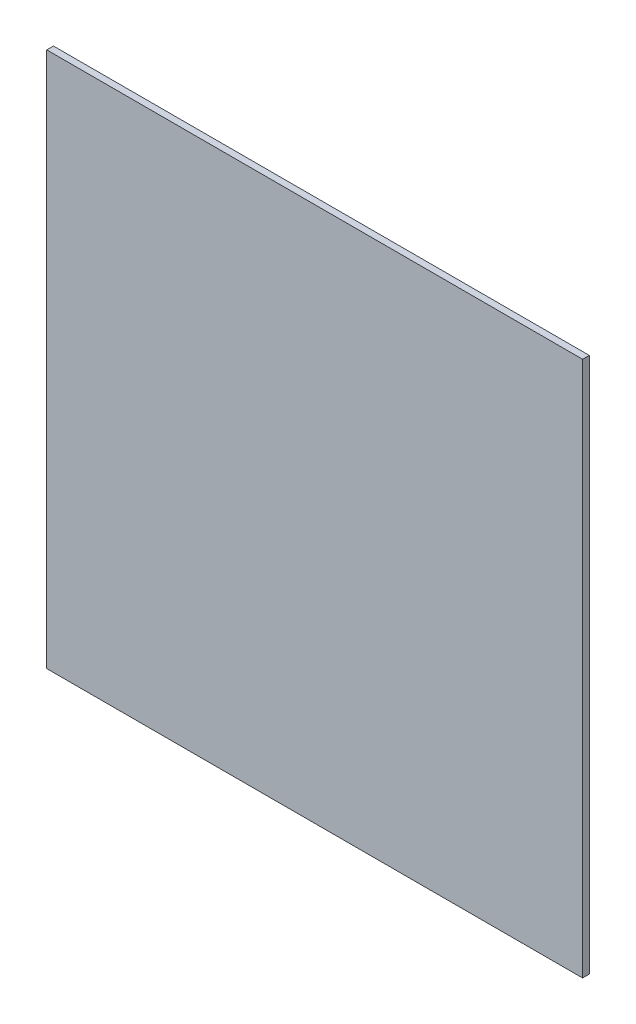
from build123d import *

# Parameters (mm, degrees)
ESQUISSE1_W        = 400
ESQUISSE1_H        = 400
BOSS_EXTRU_1_DEPTH = 5


with BuildPart() as part:
    # Esquisse1 → Boss.-Extru.1 (new body)
    with BuildSketch(Plane.XY):
        with Locations((200, 200)):
            Rectangle(ESQUISSE1_W, ESQUISSE1_H)
    extrude(amount=-BOSS_EXTRU_1_DEPTH)


solid = part.part
